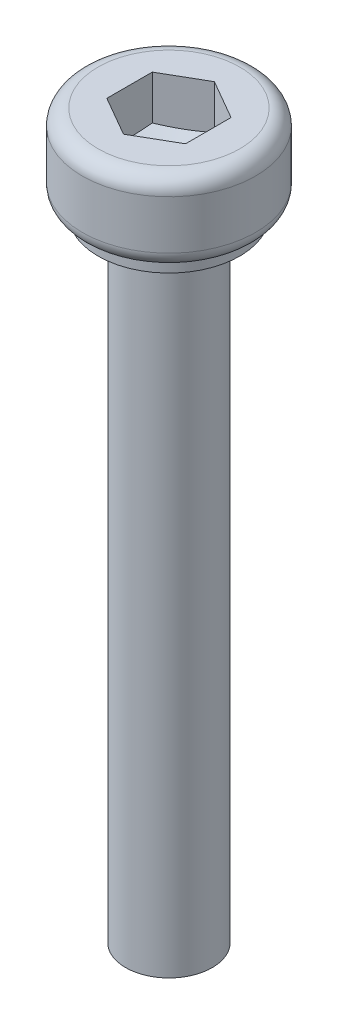
from build123d import *

# Parameters (mm, degrees)
BOSS_EXTRUDE1_DEPTH = 2


with BuildPart() as part:
    # Sketch1 → Revolve1 (revolve)
    with BuildSketch(Plane.XY):
        with BuildLine():
            Line((0, 11.475), (2.25, 11.475))
            ThreePointArc((2.25, 11.475), (2.603553391, 11.328553391), (2.75, 10.975))
            Line((2.75, 10.975), (2.75, 9.425))
            ThreePointArc((2.75, 9.425), (2.603553391, 9.071446609), (2.25, 8.925))
            Line((2.25, 8.925), (2.25, 8.525))
            Line((2.25, 8.525), (1.375, 8.525))
            Line((1.375, 8.525), (1.375, -11.475))
            Line((1.375, -11.475), (0, -11.475))
            Line((0, -11.475), (0, 11.475))
        make_face()
    revolve(axis=Axis((0, 4.094224924, 0), (0, -1, 0)))


with BuildPart() as body_2:
    # Sketch2 → Boss-Extrude1 (new body)
    with BuildSketch(Plane(origin=(0, 11.475, 0), x_dir=(1, 0, 0), z_dir=(0, 1, 0))):
        Polygon((0, 1.443375673), (-1.25, 0.721687836), (-1.25, -0.721687836), (0, -1.443375673), (1.25, -0.721687836), (1.25, 0.721687836), align=None)
    extrude(amount=-BOSS_EXTRUDE1_DEPTH)

    # Sketch3 → Cut-Revolve1 (revolve, cut)
    with BuildSketch(Plane(origin=(0, 0, 0), x_dir=(0, 0, -1), z_dir=(1, 0, 0))):
        Polygon((0, 9.875), (0.4, 9.875), (1.443375673, 10.075), (1.443375673, 9.475), (0, 9.475), align=None)
    revolve(axis=Axis((0, 9.475, 0), (0, 1, 0)), mode=Mode.SUBTRACT)


with BuildPart() as part_1:
    add(part.part)

    # Combine1: cut body 2
    add(body_2.part, mode=Mode.SUBTRACT)


solid = part_1.part
